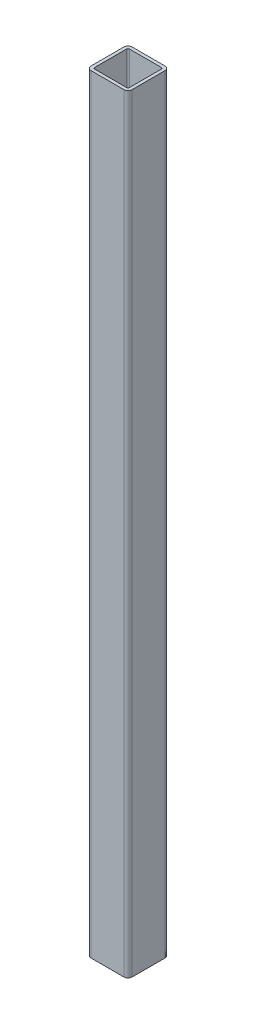
from build123d import *

# Parameters (mm, degrees)
EXTRUDE_START   = -375
EXTRUDE_1_DEPTH = 750


with BuildPart() as part:
    # Extrude sketch 1 → Extrude 1 (new body)
    with BuildSketch(Plane(origin=(0, 0, 0), x_dir=(1, 0, 0), z_dir=(0, 1, 0)).offset(EXTRUDE_START)):
        with BuildLine():
            Line((20, 16), (20, -16))
            ThreePointArc((20, -16), (18.828427125, -18.828427125), (16, -20))
            Line((16, -20), (-16, -20))
            ThreePointArc((-16, -20), (-18.828427125, -18.828427125), (-20, -16))
            Line((-20, -16), (-20, 16))
            ThreePointArc((-20, 16), (-18.828427125, 18.828427125), (-16, 20))
            Line((-16, 20), (16, 20))
            ThreePointArc((16, 20), (18.828427125, 18.828427125), (20, 16))
        make_face()
        with BuildLine():
            Line((17, 15.5), (17, -15.5))
            ThreePointArc((17, -15.5), (16.560660172, -16.560660172), (15.5, -17))
            Line((15.5, -17), (-15.5, -17))
            ThreePointArc((-15.5, -17), (-16.560660172, -16.560660172), (-17, -15.5))
            Line((-17, -15.5), (-17, 15.5))
            ThreePointArc((-17, 15.5), (-16.560660172, 16.560660172), (-15.5, 17))
            Line((-15.5, 17), (15.5, 17))
            ThreePointArc((15.5, 17), (16.560660172, 16.560660172), (17, 15.5))
        make_face(mode=Mode.SUBTRACT)
    extrude(amount=EXTRUDE_1_DEPTH)


solid = part.part
